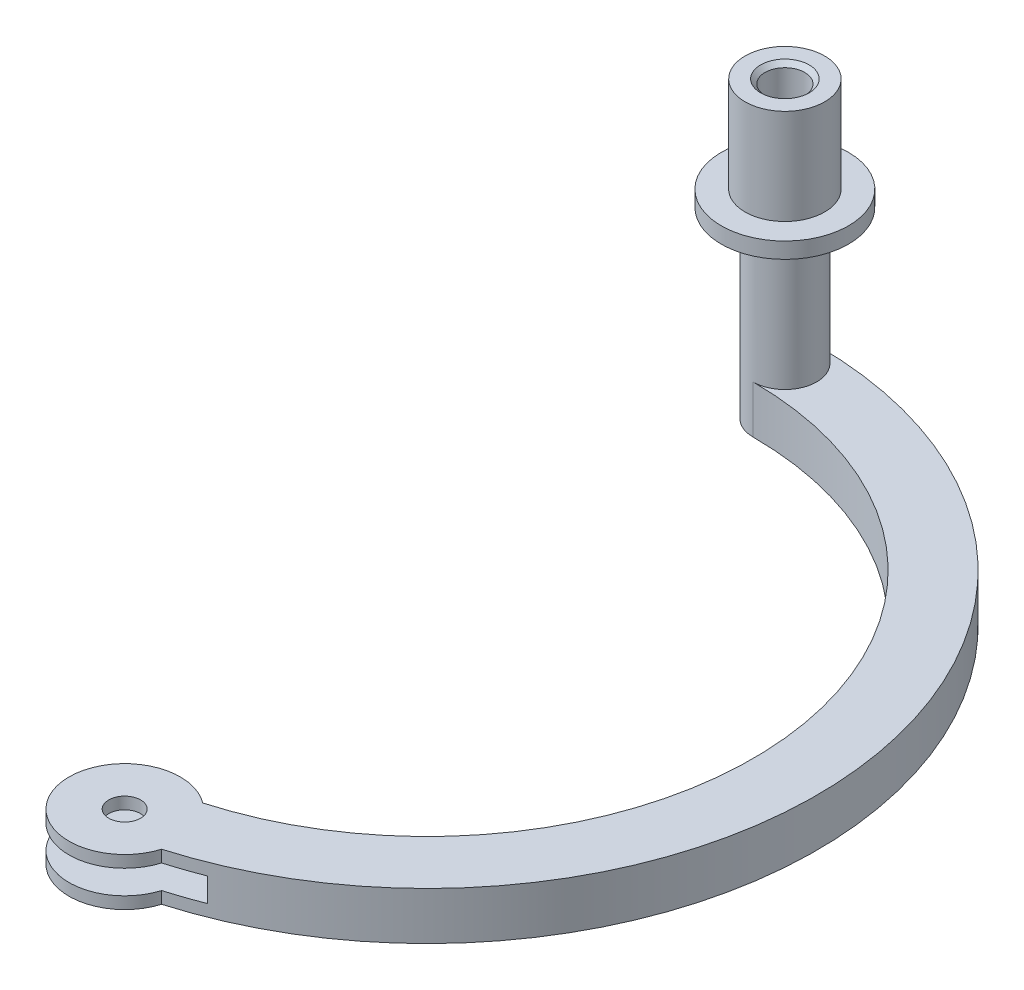
from build123d import *

# Parameters (mm, degrees)
SKETCH1_R                   = 2.5
BOSS_EXTRUDE1_DEPTH         = 6
SKETCH2_R                   = 4
BOSS_EXTRUDE2_DEPTH         = 1
BOSS_EXTRUDE3_DEPTH         = 1.5
SKETCH7_R                   = 2
BOSS_EXTRUDE4_DEPTH         = 8.5
SKETCH8_R                   = 5.5
CUT_EXTRUDE1_DEPTH          = 0.75
SKETCH9_R                   = 1
CUT_EXTRUDE2_DEPTH          = 57.504424606
M3_TAPPED_HOLE2_D           = 2.5
M3_TAPPED_HOLE2_DEPTH       = 7.5
M3_TAPPED_HOLE2_CSINK_D     = 3.05
M3_TAPPED_HOLE2_CSINK_ANGLE = 90
M3_TAPPED_HOLE2_TIP         = 0.751075774


with BuildPart() as part:
    # Sketch1 → Boss-Extrude1 (new body)
    with BuildSketch(Plane(origin=(0, 0, 0), x_dir=(1, 0, 0), z_dir=(0, 1, 0))):
        with Locations(Location((0, 0, 0), (0, 0, 270))):
            Circle(SKETCH1_R)
    extrude(amount=BOSS_EXTRUDE1_DEPTH)

    # Sketch2 → Boss-Extrude2 (add)
    with BuildSketch(Plane.XZ):
        with Locations(Location((0, 0, 0), (0, 0, 270))):
            Circle(SKETCH2_R)
    extrude(amount=BOSS_EXTRUDE2_DEPTH)



with BuildPart() as body_2:
    # Sketch6 → Boss-Extrude3 (new, symmetric)
    with BuildSketch(Plane(origin=(0, -11, 0), x_dir=(-1, 0, 0), z_dir=(0, -1, 0))):
        with BuildLine():
            ThreePointArc((-5.619513954, -42.214742274), (-0.168678351, -46.073450543), (-6.84690974, -46.02381404))
            ThreePointArc((-6.84690974, -46.02381404), (-24.254725766, -19.04192568), (0, 2))
            ThreePointArc((0, 2), (2, 0), (0, -2))
            ThreePointArc((0, -2), (-20.302736473, -19.662943128), (-5.619513954, -42.214742274))
        make_face()
    extrude(amount=BOSS_EXTRUDE3_DEPTH, both=True)


with BuildPart() as part_1:
    add(part.part)

    add(body_2.part)  # Boss-Extrude4 merges body 2
    # Sketch7 → Boss-Extrude4 (add)
    with BuildSketch(Plane.XZ.offset(1)):
        with Locations(Location((0, 0, 0), (0, 0, 270))):
            Circle(SKETCH7_R)
    extrude(amount=BOSS_EXTRUDE4_DEPTH)

    # Sketch8 → Cut-Extrude1 (cut, symmetric)
    with BuildSketch(Plane(origin=(0, -11, 0), x_dir=(1, 0, 0), z_dir=(0, 1, 0))):
        with Locations((3.5, -45)):
            Circle(SKETCH8_R)
    extrude(amount=CUT_EXTRUDE1_DEPTH, both=True, mode=Mode.SUBTRACT)

    # Sketch9 → Cut-Extrude2 (cut, through all)
    with BuildSketch(Plane(origin=(0, -9.5, 0), x_dir=(1, 0, 0), z_dir=(0, 1, 0))):
        with Locations(Location((3.5, -45, 0), (0, 0, 270))):
            Circle(SKETCH9_R)
    extrude(amount=-CUT_EXTRUDE2_DEPTH, mode=Mode.SUBTRACT)

    # M3 Tapped Hole2
    with Locations(Plane.ZX.offset(6)):
        with Locations((0, 0)):
            CounterSinkHole(M3_TAPPED_HOLE2_D / 2, M3_TAPPED_HOLE2_CSINK_D / 2, depth=M3_TAPPED_HOLE2_DEPTH, counter_sink_angle=M3_TAPPED_HOLE2_CSINK_ANGLE)
            with Locations((0, 0, -(M3_TAPPED_HOLE2_DEPTH + M3_TAPPED_HOLE2_TIP / 2))):  # 118° drill point
                Cone(0, M3_TAPPED_HOLE2_D / 2, M3_TAPPED_HOLE2_TIP, mode=Mode.SUBTRACT)


solid = part_1.part
